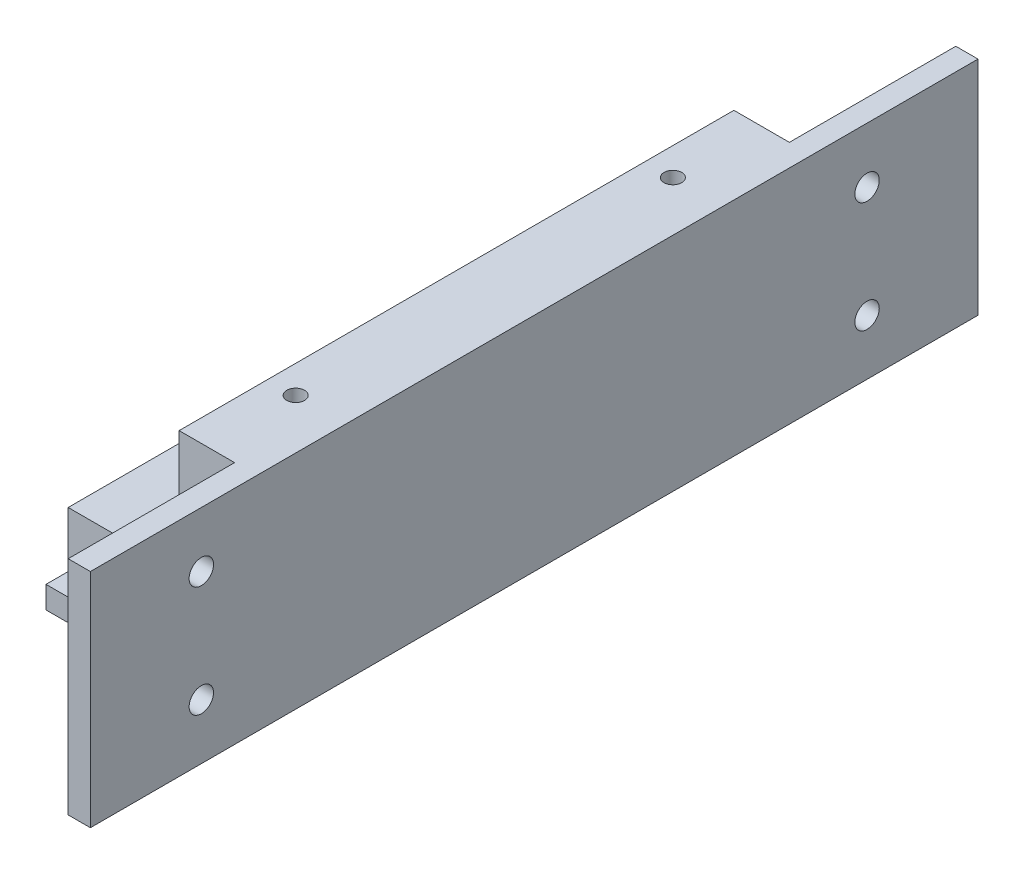
from build123d import *

# Parameters (mm, degrees)
SKETCH_1_W          = 2
SKETCH_1_H          = 50
EXTRUDE_1_DEPTH     = 2
SKETCH_3_W          = 50
SKETCH_3_H          = 20
EXTRUDE_3_DEPTH     = 20
SKETCH_4_W          = 10
SKETCH_4_H          = 11
CUT_EXTRUDE_1_DEPTH = 58.801384066
SKETCH_6_W          = 15
SKETCH_6_H          = 20
EXTRUDE_4_DEPTH     = 5
SKETCH_7_W          = 3
SKETCH_7_H          = 80
CUT_EXTRUDE_4_DEPTH = 50.406477308
SKETCH_8_R          = 1.1
CUT_EXTRUDE_5_DEPTH = 49.590122453
SKETCH_9_R          = 0.8
CUT_EXTRUDE_6_DEPTH = 2


with BuildPart() as part:
    # 草图1 → 凸台-拉伸1 (new body)
    with BuildSketch(Plane(origin=(0, 0, 0), x_dir=(1, 0, 0), z_dir=(0, 1, 0))):
        Rectangle(SKETCH_1_W, SKETCH_1_H)
    extrude(amount=EXTRUDE_1_DEPTH)

    # 草图3 → 凸台-拉伸3 (add)
    with BuildSketch(Plane(origin=(1, 0, 0), x_dir=(0, 0, -1), z_dir=(1, 0, 0))):
        with Locations((0, 10)):
            Rectangle(SKETCH_3_W, SKETCH_3_H)
    extrude(amount=EXTRUDE_3_DEPTH)

    # 草图4 → 切除-拉伸1 (cut, through all)
    with BuildSketch(Plane.XY.offset(25)):
        with Locations((6, 14.5)):
            Rectangle(SKETCH_4_W, SKETCH_4_H)
    extrude(amount=-CUT_EXTRUDE_1_DEPTH, mode=Mode.SUBTRACT)

    # 草图6 → 凸台-拉伸4 (add)
    with BuildSketch(Plane(origin=(21, 0, 0), x_dir=(0, 0, -1), z_dir=(1, 0, 0))):
        with Locations((-32.5, 10)):
            Rectangle(SKETCH_6_W, SKETCH_6_H)
        with Locations((32.5, 10)):
            Rectangle(SKETCH_6_W, SKETCH_6_H)
    extrude(amount=-EXTRUDE_4_DEPTH)

    # 草图7 → 切除-拉伸4 (cut, through all)
    with BuildSketch(Plane(origin=(0, 20, 0), x_dir=(1, 0, 0), z_dir=(0, 1, 0))):
        with Locations((19.5, 0)):
            Rectangle(SKETCH_7_W, SKETCH_7_H)
    extrude(amount=-CUT_EXTRUDE_4_DEPTH, mode=Mode.SUBTRACT)

    # 草图8 → 切除-拉伸5 (cut, through all)
    with BuildSketch(Plane(origin=(18, 0, 0), x_dir=(0, 0, -1), z_dir=(1, 0, 0))):
        with Locations((30, 15)):
            Circle(SKETCH_8_R)
        with Locations((30, 5)):
            Circle(SKETCH_8_R)
        with Locations((-30, 15)):
            Circle(SKETCH_8_R)
        with Locations((-30, 5)):
            Circle(SKETCH_8_R)
    extrude(amount=-CUT_EXTRUDE_5_DEPTH, mode=Mode.SUBTRACT)

    # 草图9 → 切除-拉伸6 (cut)
    with BuildSketch(Plane(origin=(0, 20, 0), x_dir=(1, 0, 0), z_dir=(0, 1, 0))):
        with Locations(Location((13.5, -17, 0), (0, 0, 270))):
            Circle(SKETCH_9_R)
        with Locations(Location((13.5, 17, 0), (0, 0, 270))):
            Circle(SKETCH_9_R)
    extrude(amount=-CUT_EXTRUDE_6_DEPTH, mode=Mode.SUBTRACT)


solid = part.part
